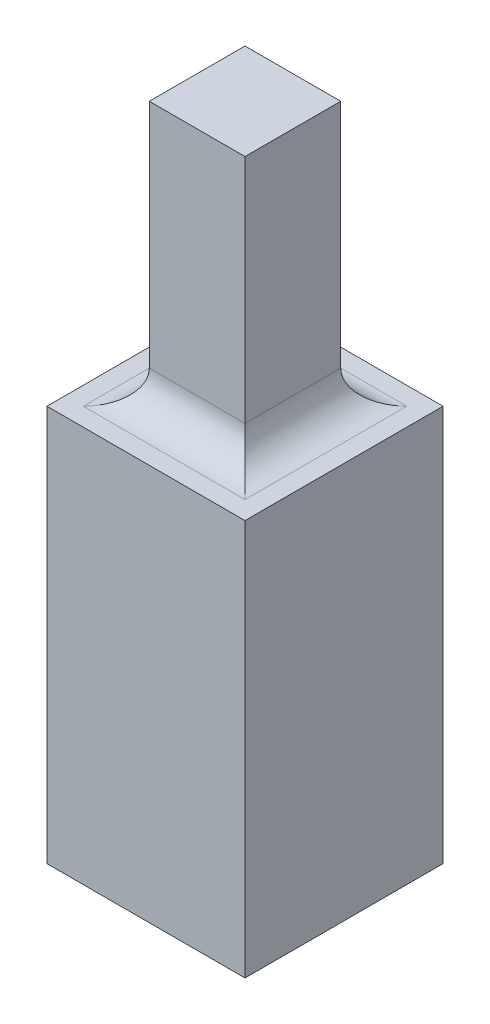
from build123d import *

# Parameters (mm, degrees)
SKETCH1_W           = 30
SKETCH1_H           = 30
BOSS_EXTRUDE1_DEPTH = 60
SKETCH2_W           = 14.5
SKETCH2_H           = 14.5
BOSS_EXTRUDE2_DEPTH = 40
FILLET1_R           = 5


with BuildPart() as part:
    # Sketch1 → Boss-Extrude1 (new body)
    with BuildSketch(Plane(origin=(0, 0, 0), x_dir=(1, 0, 0), z_dir=(0, 1, 0))):
        Rectangle(SKETCH1_W, SKETCH1_H)
    extrude(amount=BOSS_EXTRUDE1_DEPTH)

    # Sketch2 → Boss-Extrude2 (add)
    with BuildSketch(Plane(origin=(0, 60, 0), x_dir=(1, 0, 0), z_dir=(0, 1, 0))):
        Rectangle(SKETCH2_W, SKETCH2_H)
    extrude(amount=BOSS_EXTRUDE2_DEPTH)

    # Fillet1
    fillet1_edges = [part.edges().sort_by_distance(p)[0] for p in [
        (7.25, 60, 0),
        (0, 60, -7.25),
        (-7.25, 60, 0),
        (0, 60, 7.25),
    ]]
    fillet(fillet1_edges, radius=FILLET1_R)


solid = part.part
